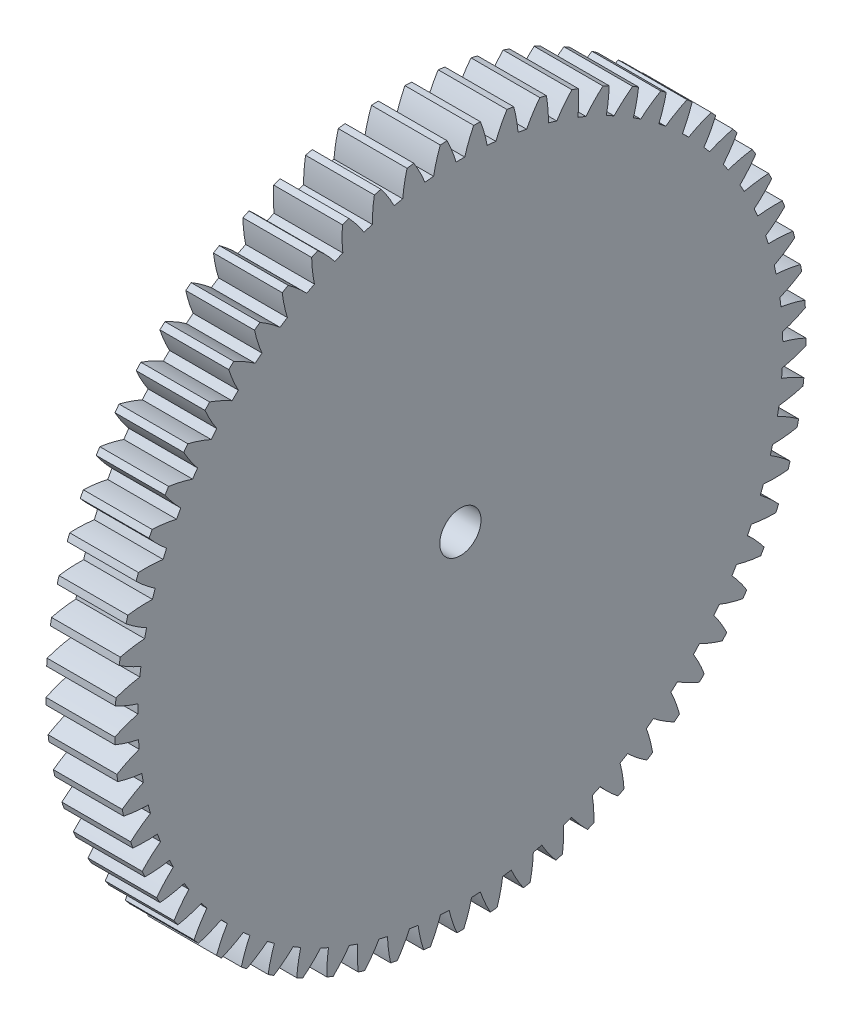
from build123d import *

# Parameters (mm, degrees)
BASPROSKE_W     = 10
BASPROSKE_H     = 50.25
TOOTHCUT_DEPTH  = 72.764371383
TEETHCUTS_COUNT = 65
TEETHCUTS_ANGLE = 354.461538462
BORSKE_R        = 3
BORE_DEPTH      = 50.0000508


with BuildPart() as part:
    # BasProSke → Base-Revolve (revolve)
    with BuildSketch(Plane(origin=(0, 0, 0), x_dir=(1, 0, 0), z_dir=(0, 1, 0)), mode=Mode.PRIVATE) as base_revolve_sk:
        with Locations((5, 25.125)):
            Rectangle(BASPROSKE_W, BASPROSKE_H)
    revolve(base_revolve_sk.sketch.rotate(Axis((-10, 0, 0), (1, 0, 0)), 180), axis=Axis((-10, 0, 0), (1, 0, 0)))

    # TooCutSke → ToothCut (cut, through all)
    with BuildSketch(Plane(origin=(0, 0, 0), x_dir=(0, 0, -1), z_dir=(1, 0, 0))):
        with BuildLine():
            ThreePointArc((0.634247417, 46.869708834), (0, 46.874), (-0.634247417, 46.869708834))
            ThreePointArc((-0.634247417, 46.869708834), (-1.211889469, 48.584174321), (-1.945937979, 50.237726566))
            ThreePointArc((-1.945937979, 50.237726566), (0, 50.2754), (1.945937979, 50.237726566))
            ThreePointArc((1.945937979, 50.237726566), (1.211889469, 48.584174321), (0.634247417, 46.869708834))
        make_face()
    toothcut = extrude(amount=TOOTHCUT_DEPTH, mode=Mode.SUBTRACT)

    # TeethCuts: ToothCut ×65 about axis
    teethcuts_axis = Axis((-10, 0, 0), (1, 0, 0))
    for i in range(1, TEETHCUTS_COUNT):
        add(toothcut.rotate(teethcuts_axis, i * TEETHCUTS_ANGLE / (TEETHCUTS_COUNT - 1)), mode=Mode.SUBTRACT)

    # BorSke → Bore (cut, symmetric)
    with BuildSketch(Plane(origin=(0, 0, 0), x_dir=(0, 0, -1), z_dir=(1, 0, 0))):
        with Locations(Location((0, 0, 0), (0, 0, 180))):
            Circle(BORSKE_R)
    extrude(amount=BORE_DEPTH, both=True, mode=Mode.SUBTRACT)


solid = part.part
